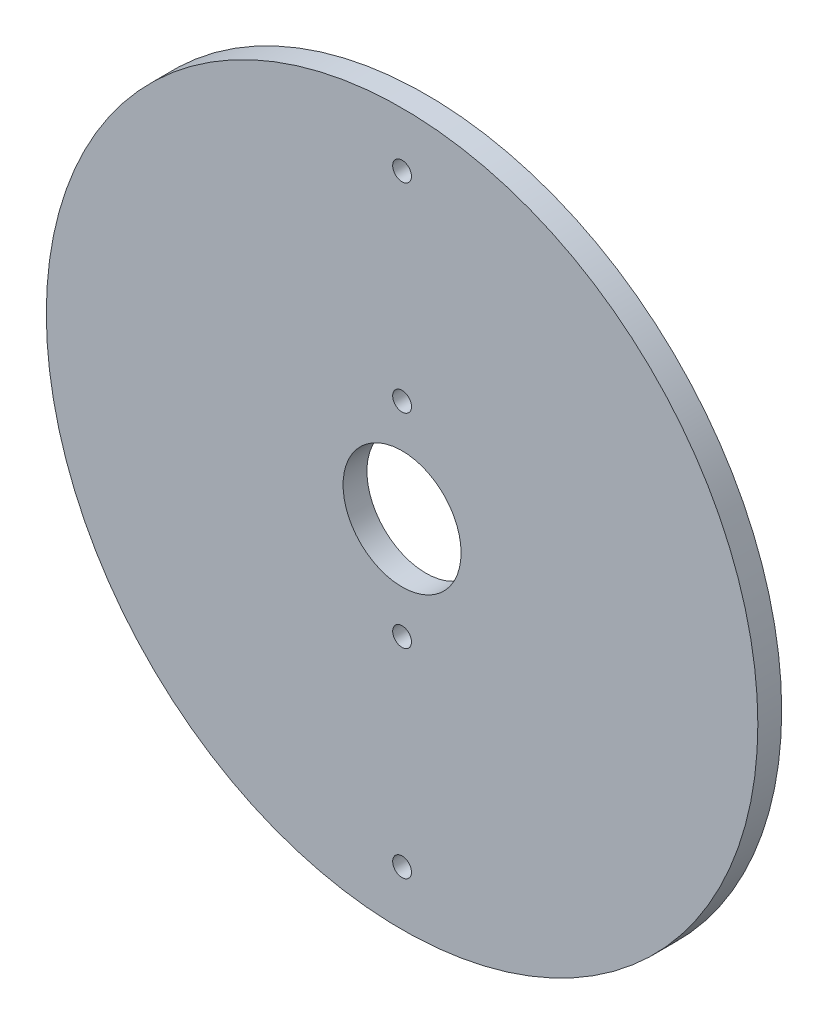
from build123d import *

# Parameters (mm, degrees)
SKETCH1_R           = 66.319019
SKETCH1_R_2         = 1.7526
SKETCH1_R_3         = 10.9982
BOSS_EXTRUDE1_DEPTH = 4.445


with BuildPart() as part:
    # Sketch1 → Boss-Extrude1 (new body)
    with BuildSketch(Plane.XY):
        Circle(SKETCH1_R)
        with Locations((0, 18.9992)):
            Circle(SKETCH1_R_2, mode=Mode.SUBTRACT)
        Circle(SKETCH1_R_3, mode=Mode.SUBTRACT)
        with Locations((0, -18.9992)):
            Circle(SKETCH1_R_2, mode=Mode.SUBTRACT)
        with Locations((0, 56.159019)):
            Circle(SKETCH1_R_2, mode=Mode.SUBTRACT)
        with Locations((0, -56.159019)):
            Circle(SKETCH1_R_2, mode=Mode.SUBTRACT)
    extrude(amount=BOSS_EXTRUDE1_DEPTH)


solid = part.part
